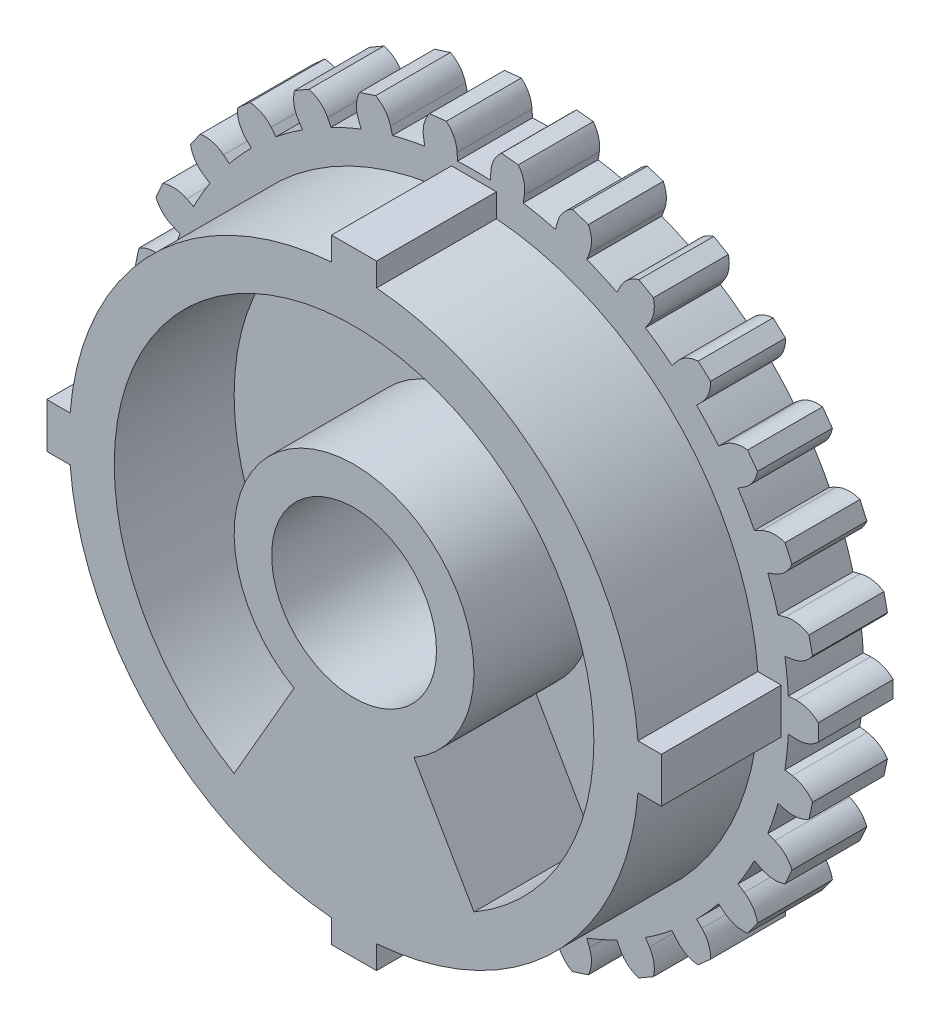
from build123d import *

# Parameters (mm, degrees)
SKETCH1_R           = 21
BOSS_EXTRUDE1_DEPTH = 2.5
SKETCH2_R           = 19
SKETCH2_R_2         = 17.5
BOSS_EXTRUDE2_DEPTH = 8
SKETCH4_R           = 5.75
CUT_EXTRUDE2_DEPTH  = 10
BOSS_EXTRUDE3_DEPTH = 5
SKETCH6_W           = 3
SKETCH6_H           = 3
BOSS_EXTRUDE4_DEPTH = 8
CIRPATTERN2_COUNT   = 4
SKETCH7_R           = 17.5
SKETCH7_R_2         = 5.5
BOSS_EXTRUDE5_DEPTH = 8
CIRPATTERN3_COUNT   = 30


with BuildPart() as part:
    # Sketch1 → Boss-Extrude1 (new, symmetric)
    with BuildSketch(Plane.XY):
        Circle(SKETCH1_R)
    extrude(amount=BOSS_EXTRUDE1_DEPTH, both=True)

    # Sketch2 → Boss-Extrude2 (add)
    with BuildSketch(Plane.XY.offset(2.5)):
        Circle(SKETCH2_R)
        Circle(SKETCH2_R_2, mode=Mode.SUBTRACT)
    extrude(amount=BOSS_EXTRUDE2_DEPTH)

    # Sketch4 → Cut-Extrude2 (cut)
    with BuildSketch(Plane(origin=(0, 0, -2.5), x_dir=(-1, 0, 0), z_dir=(0, 0, -1))):
        with Locations(Location((0, 0, 0), (0, 0, 180))):
            Circle(SKETCH4_R)
    extrude(amount=-CUT_EXTRUDE2_DEPTH, mode=Mode.SUBTRACT)

    # Sketch5 → Boss-Extrude3 (add)
    with BuildSketch(Plane.XY.offset(2.5)):
        with BuildLine():
            Line((-20.97122023, 1.099055081), (-21.47122023, 1.125258971))
            ThreePointArc((-21.47122023, 1.125258971), (-22.280227077, 0.999873909), (-22.97122023, 0.560850043))
            Line((-22.97122023, 0.560850043), (-22.97122023, -0.560850043))
            ThreePointArc((-22.97122023, -0.560850043), (-22.280227077, -0.999873909), (-21.47122023, -1.125258971))
            Line((-21.47122023, -1.125258971), (-20.97122023, -1.099055081))
            ThreePointArc((-20.97122023, -1.099055081), (-19.928255901, 0), (-20.97122023, 1.099055081))
        make_face()
    boss_extrude3 = extrude(amount=-BOSS_EXTRUDE3_DEPTH)

    # Sketch6 → Boss-Extrude4 (add)
    with BuildSketch(Plane.XY.offset(2.5)):
        with Locations((0, 19)):
            Rectangle(SKETCH6_W, SKETCH6_H)
    boss_extrude4 = extrude(amount=BOSS_EXTRUDE4_DEPTH)

    # CirPattern2: Boss-Extrude4 ×4 about axis
    cirpattern2_axis = Axis((0, 0, 0), (0, 0, 1))
    for i in range(1, CIRPATTERN2_COUNT):
        add(boss_extrude4.rotate(cirpattern2_axis, i * 360 / CIRPATTERN2_COUNT))

    # Sketch7 → Boss-Extrude5 (add)
    with BuildSketch(Plane.XY.offset(2.5)):
        Circle(SKETCH7_R)
        Circle(SKETCH7_R_2, mode=Mode.SUBTRACT)
        with BuildLine():
            Line((-4, -6.92820323), (-8, -13.856406461))
            ThreePointArc((-8, -13.856406461), (0, 16), (8, -13.856406461))
            Line((8, -13.856406461), (4, -6.92820323))
            ThreePointArc((4, -6.92820323), (0, 8), (-4, -6.92820323))
        make_face(mode=Mode.SUBTRACT)
    extrude(amount=BOSS_EXTRUDE5_DEPTH)

    # CirPattern3: Boss-Extrude3 ×30 about axis
    cirpattern3_axis = Axis((0, 0, 0), (0, 0, 1))
    for i in range(1, CIRPATTERN3_COUNT):
        add(boss_extrude3.rotate(cirpattern3_axis, i * 360 / CIRPATTERN3_COUNT))


solid = part.part
